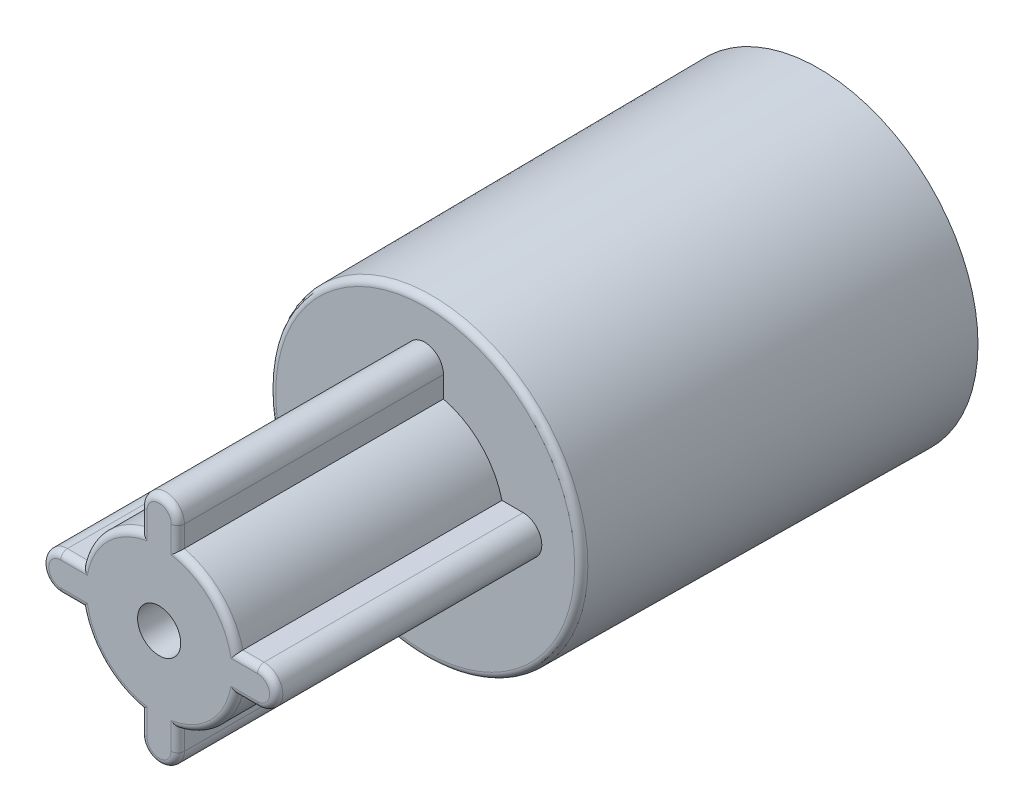
from build123d import *

# Parameters (mm, degrees)
SKETCH1_R           = 9.6
BASE_EXTRUDE_DEPTH  = 23.7
CUT_EXTRUDE1_DEPTH  = 21.7
BOSS_EXTRUDE1_DEPTH = 16
SKETCH4_R           = 1.3
CUT_EXTRUDE2_DEPTH  = 42.957240138
FILLET4_R           = 0.4


with BuildPart() as part:
    # Sketch1 → Base-Extrude (new body)
    with BuildSketch(Plane.XY):
        Circle(SKETCH1_R)
    extrude(amount=BASE_EXTRUDE_DEPTH)

    # Sketch2 → Cut-Extrude1 (cut)
    with BuildSketch(Plane(origin=(0, 0, 0), x_dir=(-1, 0, 0), z_dir=(0, 0, -1))):
        with BuildLine():
            Line((1.151331339, 6.016608995), (1.151331339, 4.741608995))
            ThreePointArc((1.151331339, 4.741608995), (3.409837287, 3.474244057), (4.677202225, 1.215738109))
            Line((4.677202225, 1.215738109), (5.952202225, 1.215738109))
            ThreePointArc((5.952202225, 1.215738109), (6.747697354, 0.886233238), (7.077202225, 0.090738109))
            ThreePointArc((7.077202225, 0.090738109), (6.747697354, -0.70475702), (5.952202225, -1.034261891))
            Line((5.952202225, -1.034261891), (4.677202225, -1.034261891))
            ThreePointArc((4.677202225, -1.034261891), (3.409837287, -3.292767839), (1.151331339, -4.560132777))
            Line((1.151331339, -4.560132777), (1.151331339, -5.835132777))
            ThreePointArc((1.151331339, -5.835132777), (0.026331339, -6.960132777), (-1.098668661, -5.835132777))
            Line((-1.098668661, -5.835132777), (-1.098668661, -4.560132777))
            ThreePointArc((-1.098668661, -4.560132777), (-3.357174609, -3.292767839), (-4.624539548, -1.034261891))
            Line((-4.624539548, -1.034261891), (-5.899539548, -1.034261891))
            ThreePointArc((-5.899539548, -1.034261891), (-6.695034676, -0.70475702), (-7.024539548, 0.090738109))
            ThreePointArc((-7.024539548, 0.090738109), (-6.695034676, 0.886233238), (-5.899539548, 1.215738109))
            Line((-5.899539548, 1.215738109), (-4.624539548, 1.215738109))
            ThreePointArc((-4.624539548, 1.215738109), (-3.357174609, 3.474244057), (-1.098668661, 4.741608995))
            Line((-1.098668661, 4.741608995), (-1.098668661, 6.016608995))
            ThreePointArc((-1.098668661, 6.016608995), (-0.76916379, 6.812104124), (0.026331339, 7.141608995))
            ThreePointArc((0.026331339, 7.141608995), (0.821826467, 6.812104124), (1.151331339, 6.016608995))
        make_face()
    extrude(amount=-CUT_EXTRUDE1_DEPTH, mode=Mode.SUBTRACT)

    # Sketch3 → Boss-Extrude1 (add)
    with BuildSketch(Plane.XY.offset(23.7)):
        with BuildLine():
            Line((-1.151331339, 6.016608995), (-1.151331339, 4.741608995))
            ThreePointArc((-1.151331339, 4.741608995), (-3.409837287, 3.474244057), (-4.677202225, 1.215738109))
            Line((-4.677202225, 1.215738109), (-5.952202225, 1.215738109))
            ThreePointArc((-5.952202225, 1.215738109), (-6.747697354, 0.886233238), (-7.077202225, 0.090738109))
            ThreePointArc((-7.077202225, 0.090738109), (-6.747697354, -0.70475702), (-5.952202225, -1.034261891))
            Line((-5.952202225, -1.034261891), (-4.677202225, -1.034261891))
            ThreePointArc((-4.677202225, -1.034261891), (-3.409837287, -3.292767839), (-1.151331339, -4.560132777))
            Line((-1.151331339, -4.560132777), (-1.151331339, -5.835132777))
            ThreePointArc((-1.151331339, -5.835132777), (-0.026331339, -6.960132777), (1.098668661, -5.835132777))
            Line((1.098668661, -5.835132777), (1.098668661, -4.560132777))
            ThreePointArc((1.098668661, -4.560132777), (3.357174609, -3.292767839), (4.624539548, -1.034261891))
            Line((4.624539548, -1.034261891), (5.899539548, -1.034261891))
            ThreePointArc((5.899539548, -1.034261891), (6.695034676, -0.70475702), (7.024539548, 0.090738109))
            ThreePointArc((7.024539548, 0.090738109), (6.695034676, 0.886233238), (5.899539548, 1.215738109))
            Line((5.899539548, 1.215738109), (4.624539548, 1.215738109))
            ThreePointArc((4.624539548, 1.215738109), (3.357174609, 3.474244057), (1.098668661, 4.741608995))
            Line((1.098668661, 4.741608995), (1.098668661, 6.016608995))
            ThreePointArc((1.098668661, 6.016608995), (0.76916379, 6.812104124), (-0.026331339, 7.141608995))
            ThreePointArc((-0.026331339, 7.141608995), (-0.821826467, 6.812104124), (-1.151331339, 6.016608995))
        make_face()
    extrude(amount=BOSS_EXTRUDE1_DEPTH)

    # Sketch4 → Cut-Extrude2 (cut, through all)
    with BuildSketch(Plane.XY.offset(39.7)):
        with Locations((-0.026331339, 0.090738109)):
            Circle(SKETCH4_R)
    extrude(amount=-CUT_EXTRUDE2_DEPTH, mode=Mode.SUBTRACT)

    # Sketch5 → Cut-Revolve1 (revolve, cut)
    with BuildSketch(Plane(origin=(0, 0, 0), x_dir=(0, 0, -1), z_dir=(1, 0, 0)), mode=Mode.PRIVATE) as cut_revolve1_sk:
        Polygon((0, 9.6), (-23.7, 9.4), (-23.7, 9.6), align=None)
    revolve(cut_revolve1_sk.sketch.rotate(Axis((0, 0, 0), (0, 0, 1)), 90), axis=Axis((0, 0, 0), (0, 0, 1)), mode=Mode.SUBTRACT)

    # Fillet4
    fillet4_edges = [part.edges().sort_by_distance(p)[0] for p in [
        (9.4, 0, 23.7),
        (-5.314702225, 1.215738109, 39.7),
        (-1.151331339, -5.197632777, 39.7),
        (1.098668661, -5.197632777, 39.7),
        (5.262039548, -1.034261891, 39.7),
        (1.098668661, 5.379108995, 39.7),
        (-0.026331339, 7.141608995, 39.7),
        (-1.151331339, 5.379108995, 39.7),
        (-3.409837287, 3.474244057, 39.7),
        (-7.077202225, 0.090738109, 39.7),
        (-5.314702225, -1.034261891, 39.7),
        (-3.409837287, -3.292767839, 39.7),
        (-0.026331339, -6.960132777, 39.7),
        (3.357174609, -3.292767839, 39.7),
        (7.024539548, 0.090738109, 39.7),
        (5.262039548, 1.215738109, 39.7),
        (3.357174609, 3.474244057, 39.7),
    ]]
    fillet(fillet4_edges, radius=FILLET4_R)


solid = part.part
